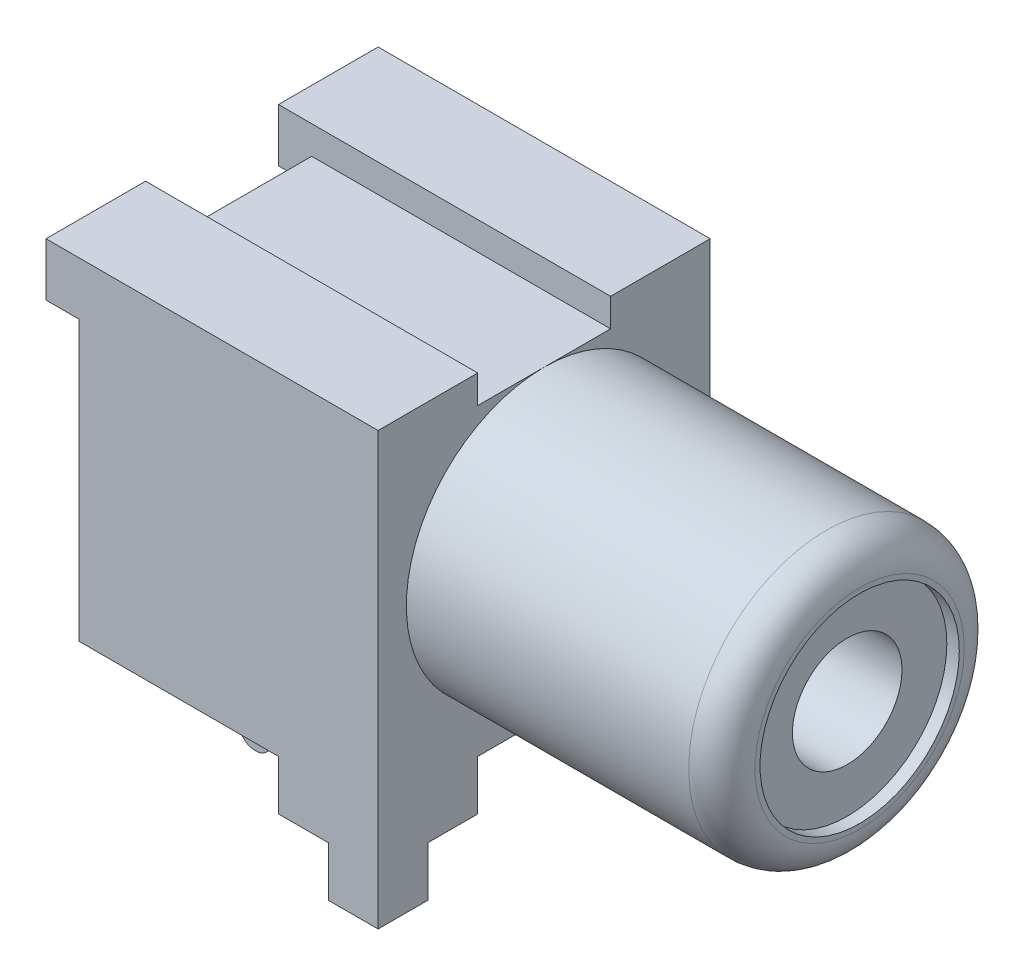
from build123d import *

# Parameters (mm, degrees)
ESBO_O1_W                                            = 10
ESBO_O1_H                                            = 11.5
RESSALTO_EXTRUS_O1_DEPTH                             = 9
ESBO_O2_W                                            = 4
ESBO_O2_H                                            = 0.85
CORTE_EXTRUS_O1_DEPTH                                = 13.175795662
ESBO_O3_W                                            = 3
ESBO_O3_H                                            = 1.6
RESSALTO_EXTRUS_O2_DEPTH                             = 1
ESBO_O4_W                                            = 3
ESBO_O4_H                                            = 1.6
RESSALTO_EXTRUS_O3_DEPTH                             = 1
ESBO_O5_W                                            = 4
ESBO_O5_H                                            = 1.5
CORTE_EXTRUS_O2_DEPTH                                = 13.932517156
ESBO_O6_W                                            = 1.5
ESBO_O6_H                                            = 1
RESSALTO_EXTRUS_O4_DEPTH                             = 1
ESBO_O7_W                                            = 1.5
ESBO_O7_H                                            = 1.5
CORTE_EXTRUS_O3_DEPTH                                = 6
ESBO_O8_W                                            = 1.5
ESBO_O8_H                                            = 1
RESSALTO_EXTRUS_O5_DEPTH                             = 1
ESBO_O9_W                                            = 1.5
ESBO_O9_H                                            = 1.5
CORTE_EXTRUS_O4_DEPTH                                = 6
ESBO_O10_W                                           = 1.5
ESBO_O10_H                                           = 1.5
RESSALTO_EXTRUS_O6_DEPTH                             = 1.5
ESBO_O11_W                                           = 1.5
ESBO_O11_H                                           = 1.5
RESSALTO_EXTRUS_O7_DEPTH                             = 1.5
ESBO_O12_W                                           = 9.5
ESBO_O12_H                                           = 4.15
REBAIXO_PARA_PARAFUSO_DE_M_QUINA_DE_CABE_D           = 3.3
REBAIXO_PARA_PARAFUSO_DE_M_QUINA_DE_CABE_DEPTH       = 9.5
REBAIXO_PARA_PARAFUSO_DE_M_QUINA_DE_CABE_CBORE_D     = 6
REBAIXO_PARA_PARAFUSO_DE_M_QUINA_DE_CABE_CBORE_DEPTH = 0.375
FILETE1_R                                            = 1
RESSALTO_EXTRUS_O9_DEPTH                             = 0.2


with BuildPart() as part:
    # Esboço1 → Ressalto-extrusão1 (new body)
    with BuildSketch(Plane(origin=(10, 0, 0), x_dir=(0, 0, -1), z_dir=(1, 0, 0))):
        with Locations((0, -0.75)):
            Rectangle(ESBO_O1_W, ESBO_O1_H)
    extrude(amount=-RESSALTO_EXTRUS_O1_DEPTH)

    # Esboço2 → Corte-extrusão1 (cut, through all)
    with BuildSketch(Plane(origin=(10, 0, 0), x_dir=(0, 0, -1), z_dir=(1, 0, 0))):
        with Locations((0, 4.575)):
            Rectangle(ESBO_O2_W, ESBO_O2_H)
    extrude(amount=-CORTE_EXTRUS_O1_DEPTH, mode=Mode.SUBTRACT)

    # Esboço3 → Ressalto-extrusão2 (add)
    with BuildSketch(Plane.ZY.offset(-1)):
        with Locations((3.5, 4.2)):
            Rectangle(ESBO_O3_W, ESBO_O3_H)
    extrude(amount=RESSALTO_EXTRUS_O2_DEPTH)

    # Esboço4 → Ressalto-extrusão3 (add)
    with BuildSketch(Plane.ZY.offset(-1)):
        with Locations((-3.5, 4.2)):
            Rectangle(ESBO_O4_W, ESBO_O4_H)
    extrude(amount=RESSALTO_EXTRUS_O3_DEPTH)

    # Esboço5 → Corte-extrusão2 (cut, through all)
    with BuildSketch(Plane(origin=(10, 0, 0), x_dir=(0, 0, -1), z_dir=(1, 0, 0))):
        with Locations((0, -5.75)):
            Rectangle(ESBO_O5_W, ESBO_O5_H)
    extrude(amount=-CORTE_EXTRUS_O2_DEPTH, mode=Mode.SUBTRACT)

    # Esboço6 → Ressalto-extrusão4 (add)
    with BuildSketch(Plane.ZY.offset(-1)):
        with Locations((2.75, -6)):
            Rectangle(ESBO_O6_W, ESBO_O6_H)
    extrude(amount=RESSALTO_EXTRUS_O4_DEPTH)

    # Esboço7 → Corte-extrusão3 (cut)
    with BuildSketch(Plane.ZY.offset(-1)):
        with Locations((4.25, -5.75)):
            Rectangle(ESBO_O7_W, ESBO_O7_H)
    extrude(amount=-CORTE_EXTRUS_O3_DEPTH, mode=Mode.SUBTRACT)

    # Esboço8 → Ressalto-extrusão5 (add)
    with BuildSketch(Plane.ZY.offset(-1)):
        with Locations((-2.75, -6)):
            Rectangle(ESBO_O8_W, ESBO_O8_H)
    extrude(amount=RESSALTO_EXTRUS_O5_DEPTH)

    # Esboço9 → Corte-extrusão4 (cut)
    with BuildSketch(Plane.ZY.offset(-1)):
        with Locations((-4.25, -5.75)):
            Rectangle(ESBO_O9_W, ESBO_O9_H)
    extrude(amount=-CORTE_EXTRUS_O4_DEPTH, mode=Mode.SUBTRACT)

    # Esboço10 → Ressalto-extrusão6 (add)
    with BuildSketch(Plane.XZ.offset(6.5)):
        with Locations((9.25, 4.25)):
            Rectangle(ESBO_O10_W, ESBO_O10_H)
    extrude(amount=RESSALTO_EXTRUS_O6_DEPTH)

    # Esboço11 → Ressalto-extrusão7 (add)
    with BuildSketch(Plane.XZ.offset(6.5)):
        with Locations((9.25, -4.25)):
            Rectangle(ESBO_O11_W, ESBO_O11_H)
    extrude(amount=RESSALTO_EXTRUS_O7_DEPTH)

    # Esboço12 → Revolução1 (revolve)
    with BuildSketch(Plane.XY, mode=Mode.PRIVATE) as revolu_o1_sk:
        with Locations((14.75, 2.075)):
            Rectangle(ESBO_O12_W, ESBO_O12_H)
    revolve(revolu_o1_sk.sketch.rotate(Axis((10, 0, 0), (1, 0, 0)), 270), axis=Axis((10, 0, 0), (1, 0, 0)))

    # Rebaixo para parafuso de máquina de cabeça sextavada de M31
    with Locations(Plane(origin=(19.5, 0, 0), x_dir=(0, 0, -1), z_dir=(1, 0, 0))):
        with Locations((0, 0)):
            CounterBoreHole(REBAIXO_PARA_PARAFUSO_DE_M_QUINA_DE_CABE_D / 2, REBAIXO_PARA_PARAFUSO_DE_M_QUINA_DE_CABE_CBORE_D / 2, REBAIXO_PARA_PARAFUSO_DE_M_QUINA_DE_CABE_CBORE_DEPTH, depth=REBAIXO_PARA_PARAFUSO_DE_M_QUINA_DE_CABE_DEPTH)

    # Filete1
    filete1_edges = [part.edges().sort_by_distance(p)[0] for p in [
        (19.5, 0, 4.15),
    ]]
    fillet(filete1_edges, radius=FILETE1_R)

    # Esboço16 → Ressalto-extrusão9 (add, symmetric)
    with BuildSketch(Plane(origin=(0, 0, 0), x_dir=(-1, 0, 0), z_dir=(0, 0, -1))):
        with BuildLine():
            Line((-2, -5), (-2, -9.5))
            ThreePointArc((-2, -9.5), (-1.569549144, -9.99513929), (-1.019348334, -9.637746055))
            Line((-1.019348334, -9.637746055), (-0.549999999, -8))
            Line((-0.549999999, -8), (-0.8, -7.928354531))
            Line((-0.8, -7.928354531), (-0.8, 3.5))
            Line((-0.8, 3.5), (-1, 3.5))
            Line((-1, 3.5), (-2, -5))
        make_face()
    extrude(amount=RESSALTO_EXTRUS_O9_DEPTH, both=True)


solid = part.part
